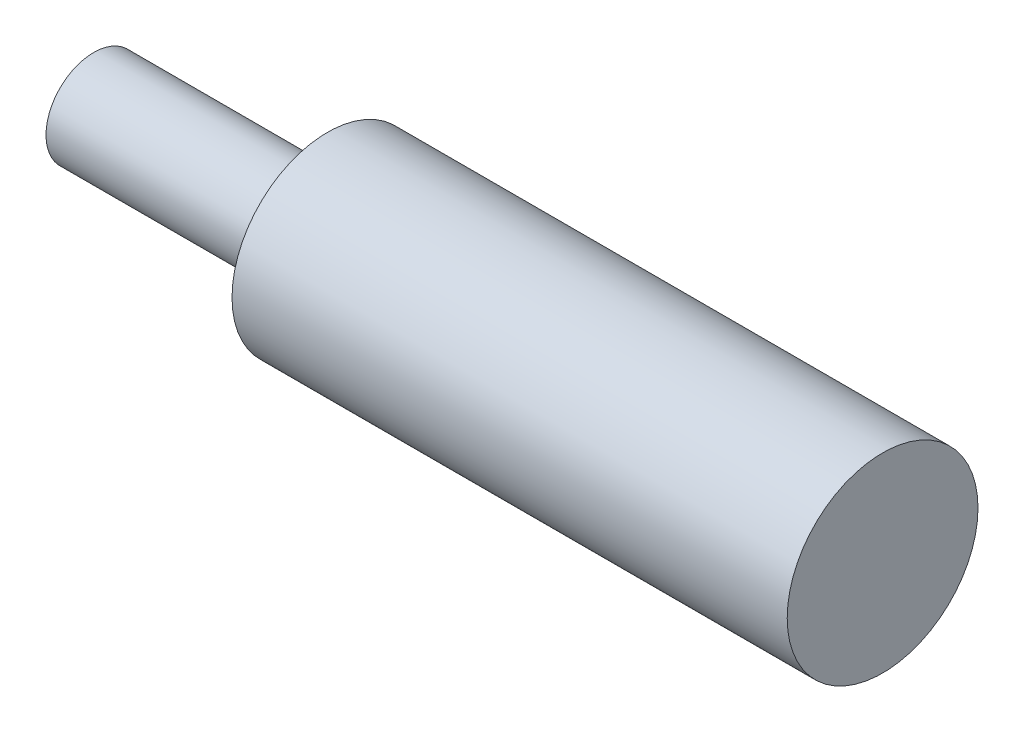
from build123d import *

# Parameters (mm, degrees)
SKETCH3_R           = 5
BASE_EXTRUDE_DEPTH  = 82.7
SKETCH4_R           = 10
BOSS_EXTRUDE1_DEPTH = 58.2


with BuildPart() as part:
    # Sketch3 → Base-Extrude (new body)
    with BuildSketch(Plane.ZY.offset(-2910.464143831)):
        with Locations((25.3342, 11.5)):
            Circle(SKETCH3_R)
    extrude(amount=-BASE_EXTRUDE_DEPTH)

    # Sketch4 → Boss-Extrude1 (add)
    with BuildSketch(Plane.ZY.offset(-2993.164143831)):
        with Locations(Location((25.3342, 11.5, 0), (0, 0, 180))):
            Circle(SKETCH4_R)
    extrude(amount=BOSS_EXTRUDE1_DEPTH)


solid = part.part
